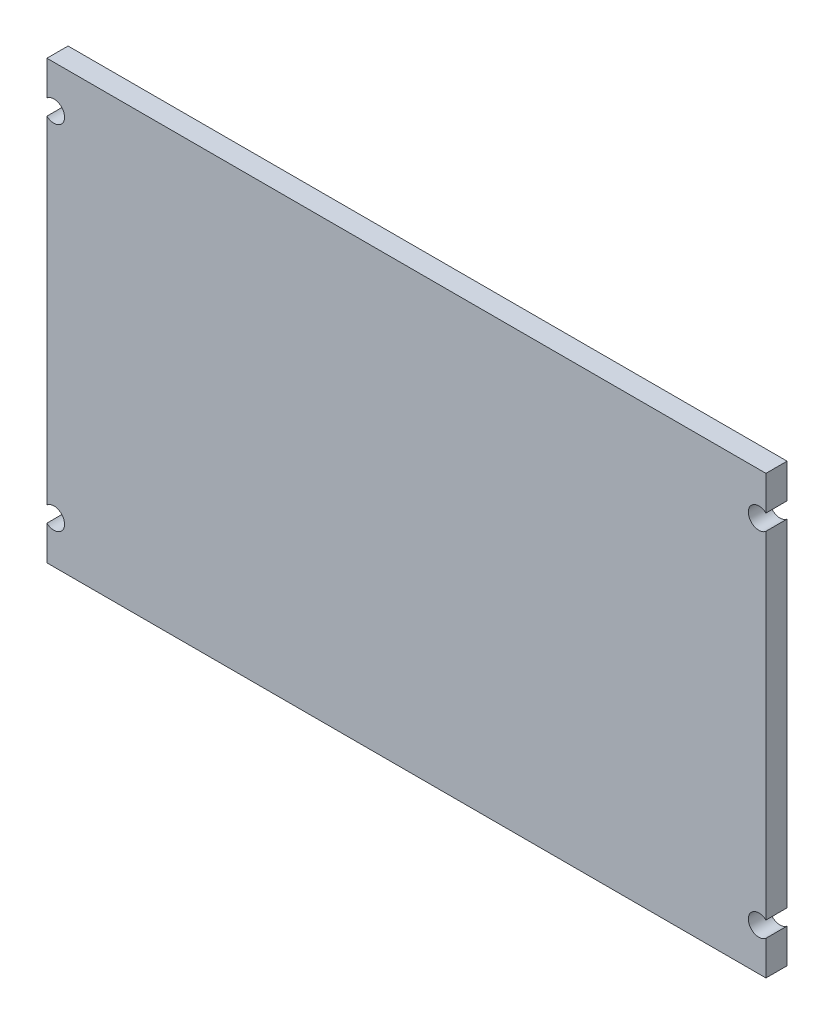
from build123d import *

# Parameters (mm, degrees)
SKETCH_1_W          = 102
SKETCH_1_H          = 62
EXTRUDE_1_DEPTH     = 3
SKETCH_2_R          = 1.5
CUT_EXTRUDE_1_DEPTH = 3


with BuildPart() as part:
    # 草图1 → 凸台-拉伸1 (new body)
    with BuildSketch(Plane.XY):
        Rectangle(SKETCH_1_W, SKETCH_1_H)
    extrude(amount=EXTRUDE_1_DEPTH)

    # 草图2 → 切除-拉伸1 (cut)
    with BuildSketch(Plane.XY.offset(3)):
        with Locations((-50, 25)):
            Circle(SKETCH_2_R)
        with Locations((50, 25)):
            Circle(SKETCH_2_R)
        with Locations((50, -25)):
            Circle(SKETCH_2_R)
        with Locations((-50, -25)):
            Circle(SKETCH_2_R)
    extrude(amount=-CUT_EXTRUDE_1_DEPTH, mode=Mode.SUBTRACT)


solid = part.part
